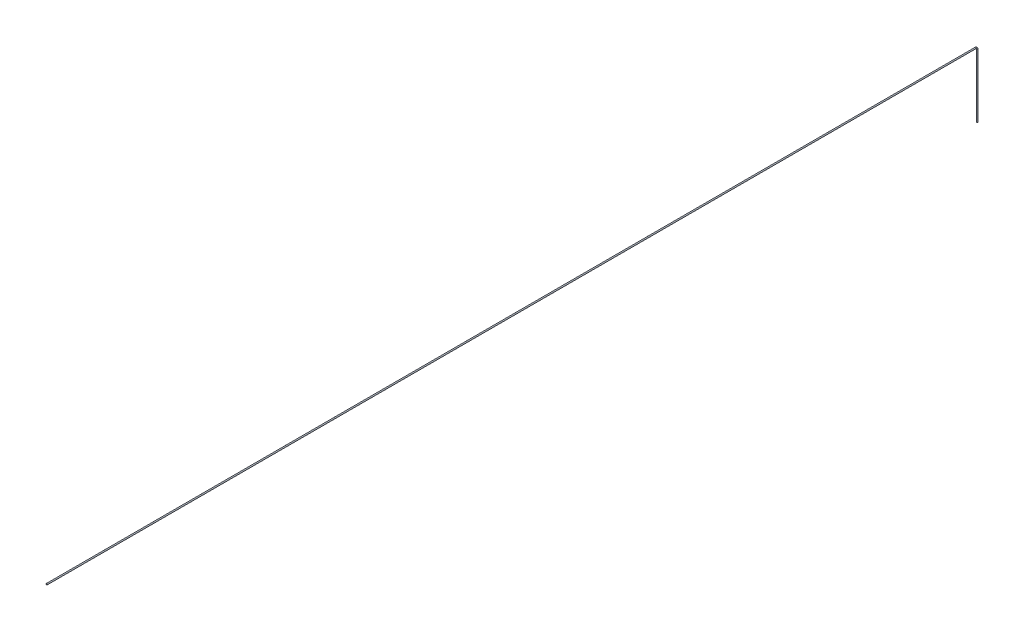
from build123d import *

# Parameters (mm, degrees)
SKETCH2_R   = 54
SKETCH2_R_2 = 50


with BuildPart() as part:
    # Sweep1: sweep along a path in Sketch1
    with BuildLine(Plane(origin=(0, 0, 0), x_dir=(0, 0, -1), z_dir=(1, 0, 0))) as sweep1_path:
        Line((0, 0), (0, 5725))
        ThreePointArc((0, 5725), (-43.933982822, 5831.066017178), (-150, 5875))
        Line((-150, 5875), (-84125, 5875))
    # Sketch2 → Sweep1 (sweep)
    with BuildSketch(Plane(origin=(0, 0, 0), x_dir=(1, 0, 0), z_dir=(0, 1, 0))):
        Circle(SKETCH2_R)
        Circle(SKETCH2_R_2, mode=Mode.SUBTRACT)
    sweep(path=sweep1_path.line)


solid = part.part
